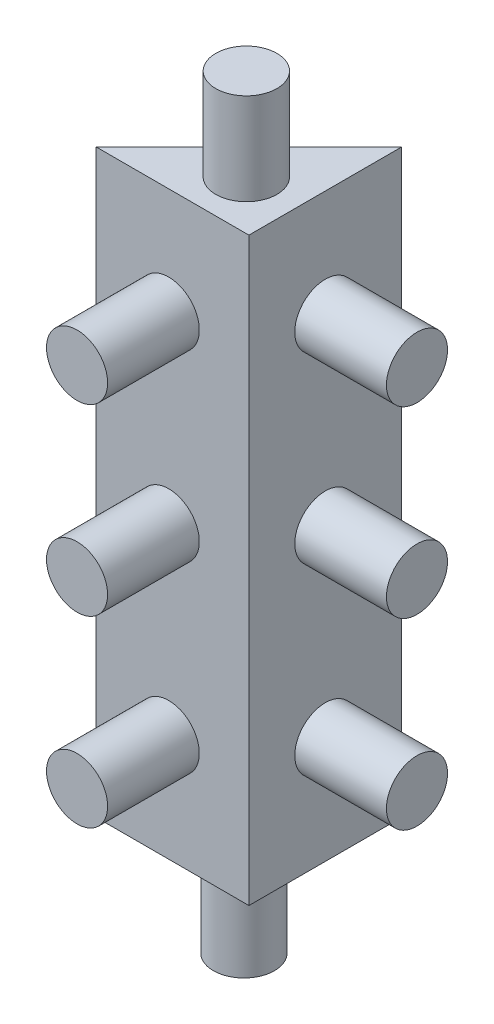
from build123d import *

# Parameters (mm, degrees)
BOSS_EXTRUDE1_DEPTH = 48.26
SKETCH6_R           = 2.54
BOSS_EXTRUDE3_DEPTH = 7.62
SKETCH7_R           = 2.54
BOSS_EXTRUDE4_DEPTH = 7.62
SKETCH8_R           = 2.54
BOSS_EXTRUDE5_DEPTH = 7.62
SKETCH9_R           = 2.54
BOSS_EXTRUDE6_DEPTH = 7.62


with BuildPart() as part:
    # Sketch4 → Boss-Extrude1 (new body)
    with BuildSketch(Plane(origin=(0, 0, 0), x_dir=(1, 0, 0), z_dir=(0, 1, 0))):
        Polygon((-6.035613044, -6.035613044), (6.664386956, 6.664386956), (6.664386956, -6.035613044), align=None)
    extrude(amount=BOSS_EXTRUDE1_DEPTH)

    # Sketch6 → Boss-Extrude3 (add)
    with BuildSketch(Plane.XY.offset(6.035613044)):
        with Locations(Location((0, 8.89, 0), (0, 0, 180))):
            Circle(SKETCH6_R)
        with Locations(Location((0, 24.13, 0), (0, 0, 180))):
            Circle(SKETCH6_R)
        with Locations(Location((0, 39.37, 0), (0, 0, 180))):
            Circle(SKETCH6_R)
    extrude(amount=BOSS_EXTRUDE3_DEPTH)

    # Sketch7 → Boss-Extrude4 (add)
    with BuildSketch(Plane(origin=(6.664386956, 0, 0), x_dir=(0, 0, -1), z_dir=(1, 0, 0))):
        with Locations(Location((0.314386956, 8.89, 0), (0, 0, 180))):
            Circle(SKETCH7_R)
        with Locations(Location((0.314386956, 24.13, 0), (0, 0, 180))):
            Circle(SKETCH7_R)
        with Locations(Location((0.314386956, 39.37, 0), (0, 0, 180))):
            Circle(SKETCH7_R)
    extrude(amount=BOSS_EXTRUDE4_DEPTH)

    # Sketch8 → Boss-Extrude5 (add)
    with BuildSketch(Plane.XZ):
        with Locations(Location((2.25920074, 2.046048879, 0), (0, 0, 90))):
            Circle(SKETCH8_R)
    extrude(amount=BOSS_EXTRUDE5_DEPTH)

    # Sketch9 → Boss-Extrude6 (add)
    with BuildSketch(Plane(origin=(0, 48.26, 0), x_dir=(1, 0, 0), z_dir=(0, 1, 0))):
        with Locations(Location((2.360435834, -1.944813785, 0), (0, 0, 270))):
            Circle(SKETCH9_R)
    extrude(amount=BOSS_EXTRUDE6_DEPTH)


solid = part.part
